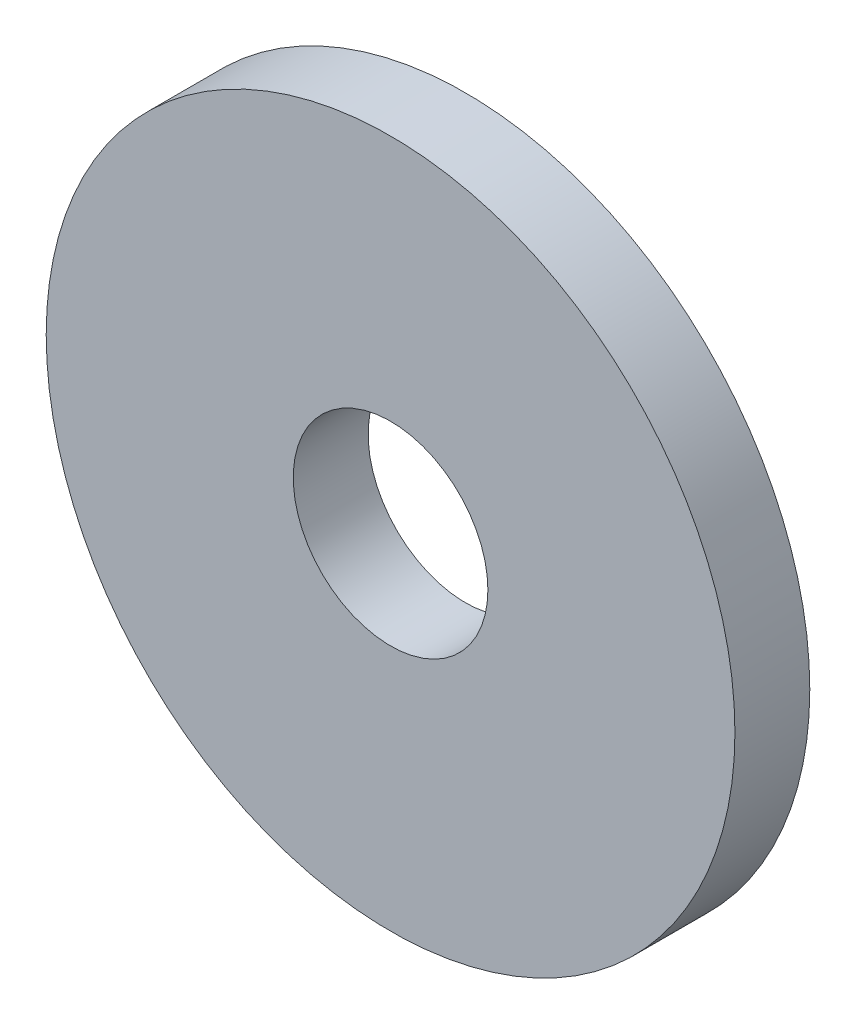
from build123d import *

# Parameters (mm, degrees)
SKETCH1_R           = 23
SKETCH1_R_2         = 6.5
BOSS_EXTRUDE1_DEPTH = 5


with BuildPart() as part:
    # Sketch1 → Boss-Extrude1 (new body)
    with BuildSketch(Plane.XY):
        Circle(SKETCH1_R)
        Circle(SKETCH1_R_2, mode=Mode.SUBTRACT)
    extrude(amount=BOSS_EXTRUDE1_DEPTH)


solid = part.part
